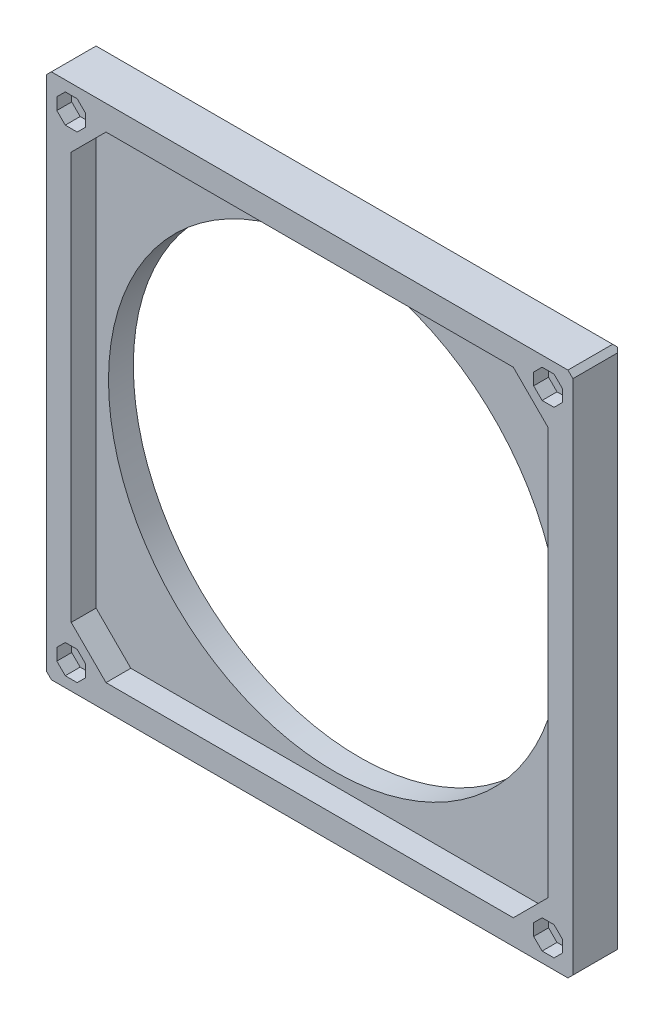
from build123d import *

# Parameters (mm, degrees)
SKETCH1_LARGER_DIA_W  = 106
SKETCH1_LARGER_DIA_H  = 106
BOSS_EXTRUDE1_DEPTH   = 5
SKETCH5_SMALLER_DIA_W = 106
SKETCH5_SMALLER_DIA_H = 106
SKETCH5_SMALLER_DIA_R = 45.5
BOSS_EXTRUDE2_DEPTH   = 5
CUT_EXTRUDE1_DEPTH    = 3
CHAMFER2_SIZE         = 1
CHAMFER3_SIZE         = 1


with BuildPart() as part:
    # Sketch1 larger dia → Boss-Extrude1 (new body)
    with BuildSketch(Plane.XY):
        Rectangle(SKETCH1_LARGER_DIA_W, SKETCH1_LARGER_DIA_H)
        Polygon((-41, 48), (41, 48), (48, 41), (48, -41), (41, -48), (-41, -48), (-48, -41), (-48, 41), align=None, mode=Mode.SUBTRACT)
    extrude(amount=BOSS_EXTRUDE1_DEPTH)

    # Sketch5 smaller dia → Boss-Extrude2 (add)
    with BuildSketch(Plane(origin=(0, 0, 0), x_dir=(-1, 0, 0), z_dir=(0, 0, -1))):
        Rectangle(SKETCH5_SMALLER_DIA_W, SKETCH5_SMALLER_DIA_H)
        Circle(SKETCH5_SMALLER_DIA_R, mode=Mode.SUBTRACT)
    extrude(amount=BOSS_EXTRUDE2_DEPTH)

    # Sketch1 → Cut-Extrude1 (cut)
    with BuildSketch(Plane.XY.offset(5)):
        Polygon((-45.1, 46.798780669), (-45.1, 49.201219331), (-46.798780669, 50.9), (-49.201219331, 50.9), (-50.9, 49.201219331), (-50.9, 46.798780669), (-49.201219331, 45.1), (-46.798780669, 45.1), align=None)
        Polygon((-46.798780669, -45.1), (-45.1, -46.798780669), (-45.1, -49.201219331), (-46.798780669, -50.9), (-49.201219331, -50.9), (-50.9, -49.201219331), (-50.9, -46.798780669), (-49.201219331, -45.1), align=None)
        Polygon((46.798780669, 45.1), (45.1, 46.798780669), (45.1, 49.201219331), (46.798780669, 50.9), (49.201219331, 50.9), (50.9, 49.201219331), (50.9, 46.798780669), (49.201219331, 45.1), align=None)
        Polygon((45.1, -46.798780669), (45.1, -49.201219331), (46.798780669, -50.9), (49.201219331, -50.9), (50.9, -49.201219331), (50.9, -46.798780669), (49.201219331, -45.1), (46.798780669, -45.1), align=None)
    extrude(amount=-CUT_EXTRUDE1_DEPTH, mode=Mode.SUBTRACT)

    # Chamfer2
    chamfer2_edges = [part.edges().sort_by_distance(p)[0] for p in [
        (53, 0, -5),
        (0, -53, -5),
        (-53, 0, -5),
        (0, 53, -5),
    ]]
    chamfer(chamfer2_edges, length=CHAMFER2_SIZE)

    # Chamfer3
    chamfer3_edges = [part.edges().sort_by_distance(p)[0] for p in [
        (-53, 53, 0.5),
        (53, 53, 0.5),
        (53, -53, 0.5),
        (-53, -53, 0.5),
    ]]
    chamfer(chamfer3_edges, length=CHAMFER3_SIZE)


solid = part.part
